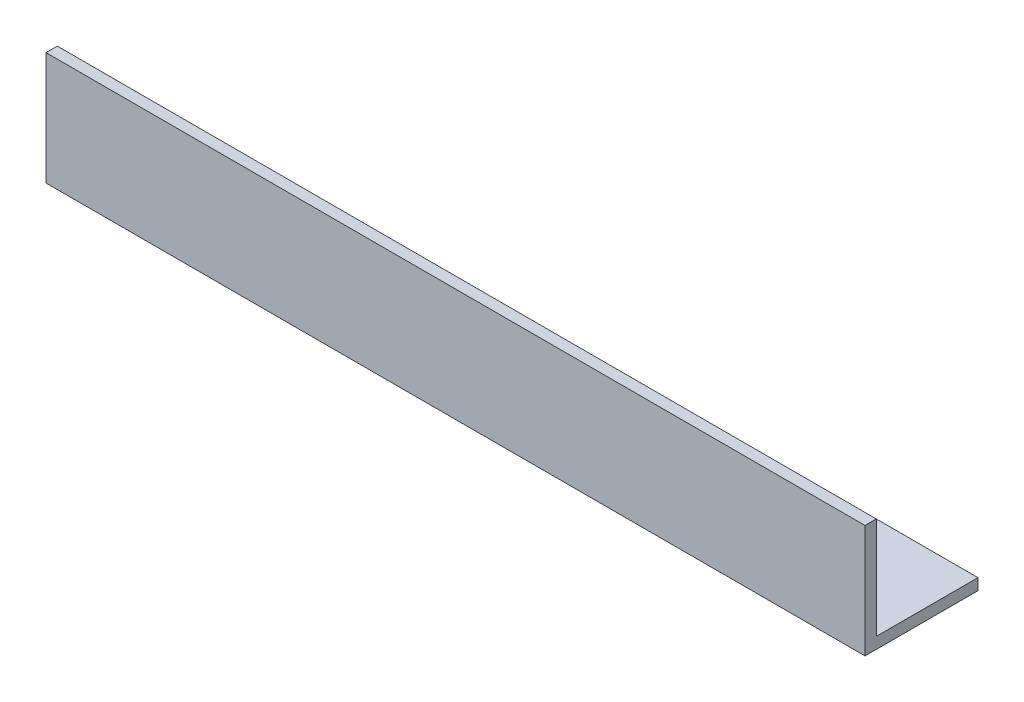
from build123d import *

# Parameters (mm, degrees)
BOSS_EXTRUDE1_DEPTH = 145
SKETCH2_R           = 2.5
CUT_EXTRUDE1_DEPTH  = 2


with BuildPart() as part:
    # Sketch1 → Boss-Extrude1 (new body)
    with BuildSketch(Plane(origin=(0, 0, 0), x_dir=(0, 0, -1), z_dir=(1, 0, 0))):
        Polygon((0, 20), (0, 0), (20, 0), (20, 2), (2, 2), (2, 20), align=None)
    extrude(amount=BOSS_EXTRUDE1_DEPTH)

    # Sketch2 → Cut-Extrude1 (cut)
    with BuildSketch(Plane(origin=(0, 2, 0), x_dir=(1, 0, 0), z_dir=(0, 1, 0))):
        with Locations(Location((8, 11, 0), (0, 0, 270))):
            Circle(SKETCH2_R)
        with Locations(Location((40, 11, 0), (0, 0, 270))):
            Circle(SKETCH2_R)
    extrude(amount=-CUT_EXTRUDE1_DEPTH, mode=Mode.SUBTRACT)


solid = part.part
